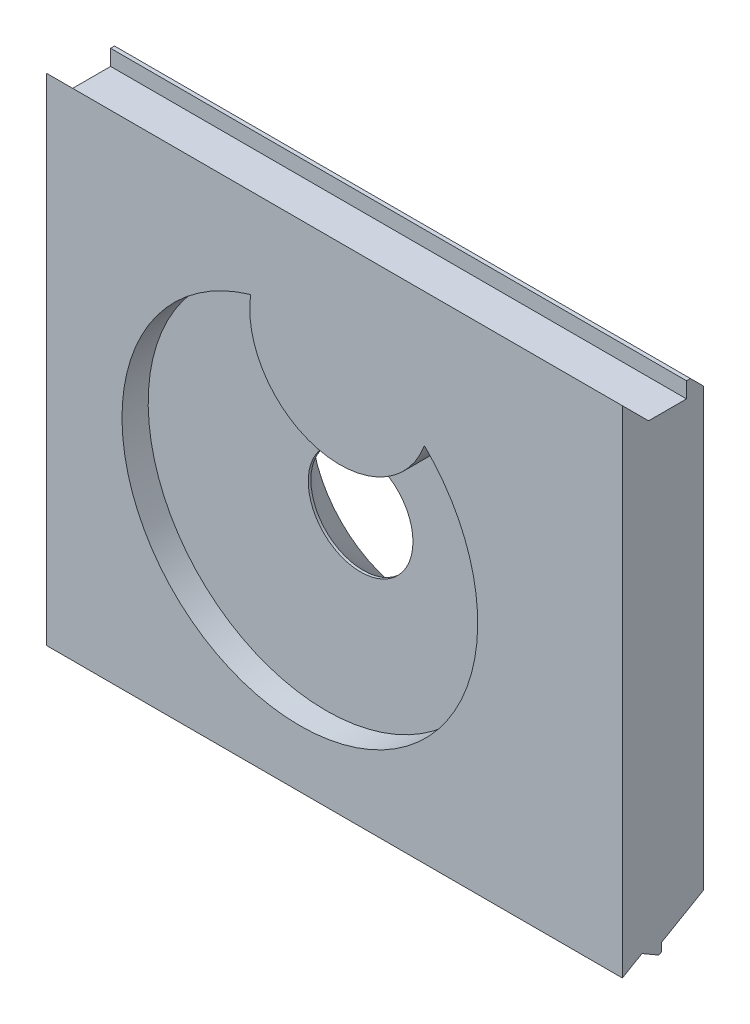
from build123d import *

# Parameters (mm, degrees)
BOSS_EXTRUDE1_DEPTH                          = 22
CUT_EXTRUDE1_DEPTH                           = 31.044799883
CUT_EXTRUDE1_DEPTH_BACK                      = 31.044799883
SKETCH4_R                                    = 4
CHAMFER1_SIZE                                = 1
CHAMFER2_SIZE                                = 4
CSK_FOR_M3_COUNTERSUNK_FLAT_HEAD_SCR_2_COUNT = 2
CSK_FOR_M3_COUNTERSUNK_FLAT_HEAD_SCR_2_PITCH = 21
CSK_FOR_M3_COUNTERSUNK_FLAT_HEAD_SCR_3_COUNT = 2
CSK_FOR_M3_COUNTERSUNK_FLAT_HEAD_SCR_3_PITCH = 24.43869882
CSK_FOR_M3_COUNTERSUNK_FLAT_HEAD_SCR_4_COUNT = 2
CSK_FOR_M3_COUNTERSUNK_FLAT_HEAD_SCR_4_PITCH = 12.5
FILLET1_R                                    = 0.2
CUT_EXTRUDE2_DEPTH                           = 2


with BuildPart() as part:
    # Sketch2 → Boss-Extrude1 (new, symmetric)
    with BuildSketch(Plane(origin=(0, 0, 0), x_dir=(0, 0, -1), z_dir=(1, 0, 0))):
        Polygon((2, 17.5), (4.9, 17.5), (4.9, 18.7), (6.2, 18.7), (6.2, -15.652479139), (3, -17.5), (3, -18.366025404), (1.5, -17.5), (0, -18.366025404), (0, -17.5), (0, 17.5), (0, 19.5), align=None)
    extrude(amount=BOSS_EXTRUDE1_DEPTH, both=True)

    # Sketch4 → Cut-Extrude1 (cut, two sides: drawn at the far end of the back side and taken through both)
    with BuildSketch(Plane.XY.offset(-CUT_EXTRUDE1_DEPTH_BACK)):
        with Locations((0, 0.5)):
            Circle(SKETCH4_R)
    extrude(amount=CUT_EXTRUDE1_DEPTH + CUT_EXTRUDE1_DEPTH_BACK, mode=Mode.SUBTRACT)

    # Chamfer1
    chamfer1_edges = [part.edges().sort_by_distance(p)[0] for p in [
        (0, 18.7, -6.2),
    ]]
    chamfer(chamfer1_edges, length=CHAMFER1_SIZE)

    # Chamfer2
    chamfer2_edges = [part.edges().sort_by_distance(p)[0] for p in [
        (-4, 0.5, -6.2),
    ]]
    chamfer(chamfer2_edges, length=CHAMFER2_SIZE)

    # Sketch7 → CSK for M3 Countersunk Flat Head Screw1 (revolve, cut)
    with BuildSketch(Plane(origin=(10.5, 12.5, -6.2), x_dir=(0, 1, 0), z_dir=(1, 0, 0))):
        Polygon((0, 0), (0, 3.030043031), (0.05, 3), (0.05, 3.1), (3.15, 0), align=None)
    csk_for_m3_countersunk_flat_head_screw1 = revolve(axis=Axis((10.5, 12.5, -12.55), (0, 0, 1)), mode=Mode.SUBTRACT)

    # CSK for M3 Countersunk Flat Head Scr 2: CSK for M3 Countersunk Flat Head Screw1 ×2
    with Locations(*[(-i * CSK_FOR_M3_COUNTERSUNK_FLAT_HEAD_SCR_2_PITCH, 0, 0) for i in range(1, CSK_FOR_M3_COUNTERSUNK_FLAT_HEAD_SCR_2_COUNT)]):
        add(csk_for_m3_countersunk_flat_head_screw1, mode=Mode.SUBTRACT)

    # CSK for M3 Countersunk Flat Head Scr 3: CSK for M3 Countersunk Flat Head Screw1 ×2
    with Locations(*[Vector(-0.8592928844097067, -0.5114838597676826, 0) * (i * CSK_FOR_M3_COUNTERSUNK_FLAT_HEAD_SCR_3_PITCH) for i in range(1, CSK_FOR_M3_COUNTERSUNK_FLAT_HEAD_SCR_3_COUNT)]):
        add(csk_for_m3_countersunk_flat_head_screw1, mode=Mode.SUBTRACT)

    # CSK for M3 Countersunk Flat Head Scr 4: CSK for M3 Countersunk Flat Head Screw1 ×2
    with Locations(*[(0, -i * CSK_FOR_M3_COUNTERSUNK_FLAT_HEAD_SCR_4_PITCH, 0) for i in range(1, CSK_FOR_M3_COUNTERSUNK_FLAT_HEAD_SCR_4_COUNT)]):
        add(csk_for_m3_countersunk_flat_head_screw1, mode=Mode.SUBTRACT)

    # Fillet1
    fillet1_edges = [part.edges().sort_by_distance(p)[0] for p in [
        (0, -18.366025404, -3),
    ]]
    fillet(fillet1_edges, radius=FILLET1_R)

    # Sketch3 → Cut-Extrude2 (cut)
    with BuildSketch(Plane.XY):
        with BuildLine():
            ThreePointArc((6.875473952, 9.29422206), (-1.27095435, 5.012578964), (-6.403163839, 12.651766581))
            ThreePointArc((-6.403163839, 12.651766581), (-5.971888857, -13.578985861), (6.875473952, 9.29422206))
        make_face()
    extrude(amount=-CUT_EXTRUDE2_DEPTH, mode=Mode.SUBTRACT)


solid = part.part
